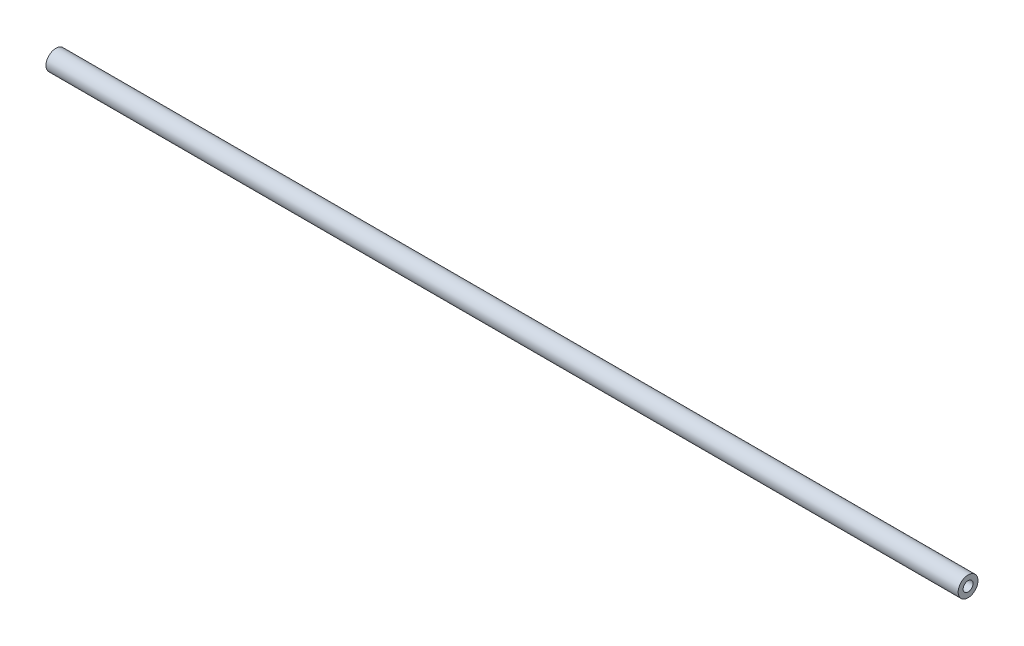
from build123d import *

# Parameters (mm, degrees)
SKETCH1_R           = 1.5875
SKETCH1_R_2         = 0.79375
BOSS_EXTRUDE1_DEPTH = 146.05


with BuildPart() as part:
    # Sketch1 → Boss-Extrude1 (new body)
    with BuildSketch(Plane(origin=(0, 0, 0), x_dir=(0, 0, -1), z_dir=(1, 0, 0))):
        Circle(SKETCH1_R)
        Circle(SKETCH1_R_2, mode=Mode.SUBTRACT)
    extrude(amount=BOSS_EXTRUDE1_DEPTH)


solid = part.part
